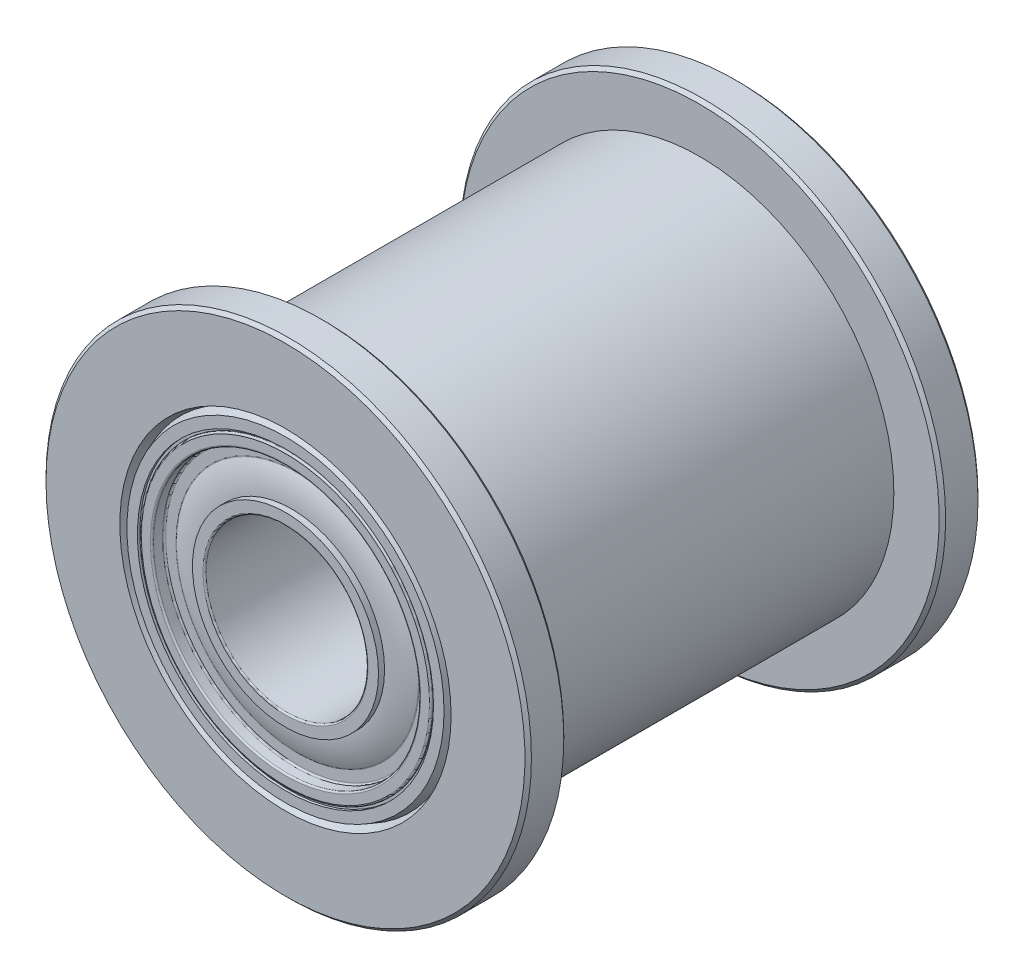
from build123d import *

# Parameters (mm, degrees)
CHAMFER1_SIZE = 0.1
FILLET2_R     = 0.05


with BuildPart() as part:
    # Sketch2 → Revolve1 (revolve)
    with BuildSketch(Plane(origin=(0, 0, 0), x_dir=(0, 0, -1), z_dir=(1, 0, 0))):
        with BuildLine():
            Line((7, 2.5), (0, 2.5))
            Line((0, 2.5), (0, 4.5))
            Line((0, 4.5), (7, 4.5))
            Line((7, 4.5), (7, 4.125))
            Line((7, 4.125), (6.625, 4.125))
            Line((6.625, 4.125), (6.625, 3.75))
            ThreePointArc((6.625, 3.75), (6.765098905, 3.322431908), (6.8125, 2.875))
            Line((6.8125, 2.875), (7, 2.875))
            Line((7, 2.875), (7, 2.5))
        make_face()
    revolve(axis=Axis((0, 0, 7), (0, 0, -1)))

    # Mirror1: part across plane


with BuildPart() as part_1:
    add(part.part)
    add(part.part.mirror(Plane.XY))

    # Fillet2
    fillet2_edges = [part_1.edges().sort_by_distance(p)[0] for p in [
        (0, -3.75, 6.625),
        (0, -4.125, 6.625),
        (0, -4.5, 7),
        (0, -4.125, 7),
        (0, -2.5, 7),
        (0, -2.5, -7),
        (0, -4.5, -7),
        (0, -3.75, -6.625),
        (0, -4.125, -7),
        (0, -2.875, -7),
    ]]
    fillet(fillet2_edges, radius=FILLET2_R)


with BuildPart() as body_2:
    # Sketch3 → Revolve2 (revolve)
    with BuildSketch(Plane(origin=(0, 0, 0), x_dir=(0, 0, -1), z_dir=(1, 0, 0))):
        Polygon((5.8, 7.5), (7, 7.5), (7, 5.118382141), (6.7, 5.00919107), (7, 4.9), (7, 4.575), (6.925, 4.575), (6.925, 4.5), (-6.925, 4.5), (-6.925, 4.575), (-7, 4.575), (-7, 4.9), (-6.7, 5.00919107), (-7, 5.118382141), (-7, 7.5), (-5.8, 7.5), (-5.8, 6), (5.8, 6), align=None)
    revolve(axis=Axis((0, 0, 7), (0, 0, -1)))

    # Chamfer1
    chamfer1_edges = [body_2.edges().sort_by_distance(p)[0] for p in [
        (0, -7.5, -7),
        (0, -7.5, -5.8),
        (0, -7.5, 5.8),
        (0, -7.5, 7),
    ]]
    chamfer(chamfer1_edges, length=CHAMFER1_SIZE)

    # Combine1: union part
    add(part_1.part)


solid = body_2.part
